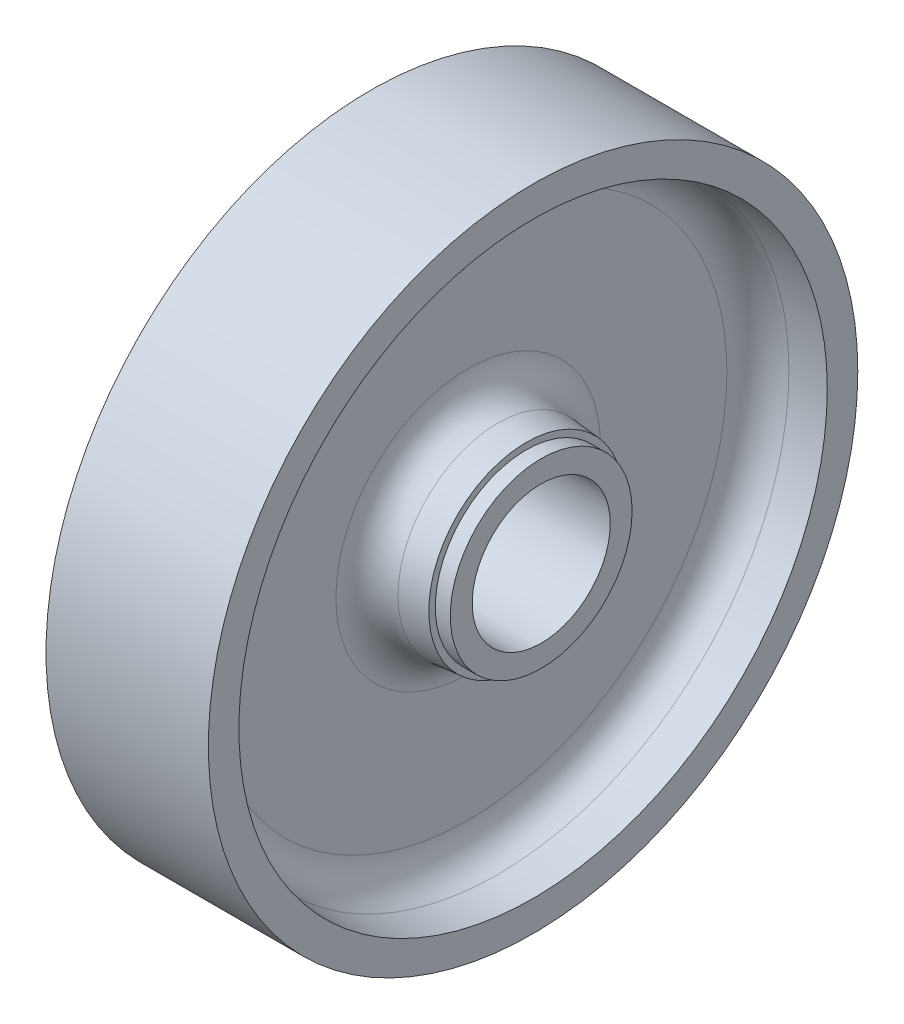
from build123d import *


with BuildPart() as part:
    # Esboço1 → Revolução1 (revolve)
    with BuildSketch(Plane.XY, mode=Mode.PRIVATE) as revolu_o1_sk:
        with BuildLine():
            Line((-14.5288, 17.78), (-17.4625, 17.78))
            Line((-17.4625, 17.78), (-17.4625, 13.5001))
            Line((-17.4625, 13.5001), (17.4625, 13.5001))
            Line((17.4625, 13.5001), (17.4625, 17.78))
            Line((17.4625, 17.78), (14.5288, 17.78))
            Line((14.5288, 17.78), (14.5288, 19.05))
            Line((14.5288, 19.05), (8.971561034, 19.53619541))
            ThreePointArc((8.971561034, 19.53619541), (4.843288911, 21.572033925), (3.175, 25.862031743))
            Line((3.175, 25.862031743), (3.175, 50.601191018))
            ThreePointArc((3.175, 50.601191018), (4.843288911, 54.891188837), (8.971561034, 56.927027351))
            Line((8.971561034, 56.927027351), (15.875, 57.531))
            Line((15.875, 57.531), (15.875, 63.5))
            Line((15.875, 63.5), (-15.875, 63.5))
            Line((-15.875, 63.5), (-15.875, 57.531))
            Line((-15.875, 57.531), (-8.971561034, 56.927027351))
            ThreePointArc((-8.971561034, 56.927027351), (-4.843288911, 54.891188837), (-3.175, 50.601191018))
            Line((-3.175, 50.601191018), (-3.175, 25.862031743))
            ThreePointArc((-3.175, 25.862031743), (-4.843288911, 21.572033925), (-8.971561034, 19.53619541))
            Line((-8.971561034, 19.53619541), (-14.5288, 19.05))
            Line((-14.5288, 19.05), (-14.5288, 17.78))
        make_face()
    revolve(revolu_o1_sk.sketch.rotate(Axis((-17.4625, 0, 0), (1, 0, 0)), 270), axis=Axis((-17.4625, 0, 0), (1, 0, 0)))


solid = part.part
